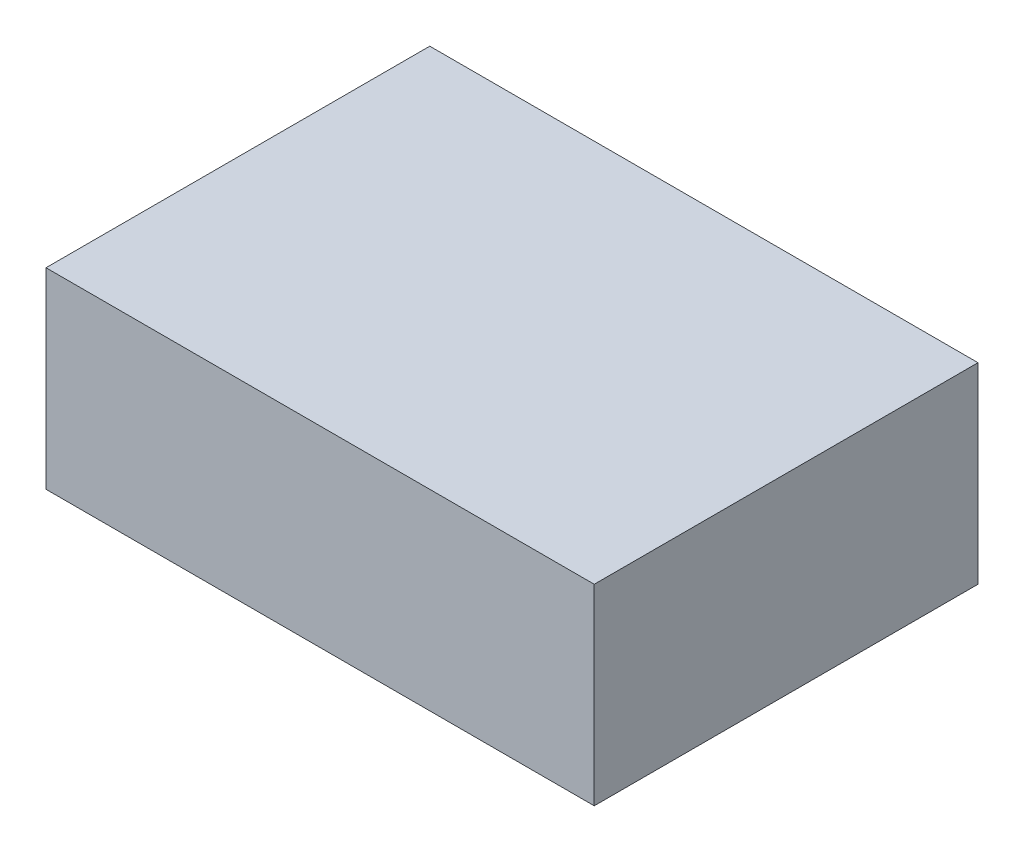
from build123d import *

# Parameters (mm, degrees)
SKIZZE1_W                       = 100
SKIZZE1_H                       = 70
AUFSATZ_LINEAR_AUSTRAGEN1_DEPTH = 35


with BuildPart() as part:
    # Skizze1 → Aufsatz-Linear austragen1 (new body)
    with BuildSketch(Plane(origin=(0, 0, 0), x_dir=(1, 0, 0), z_dir=(0, 1, 0))):
        Rectangle(SKIZZE1_W, SKIZZE1_H)
    extrude(amount=AUFSATZ_LINEAR_AUSTRAGEN1_DEPTH)


solid = part.part
